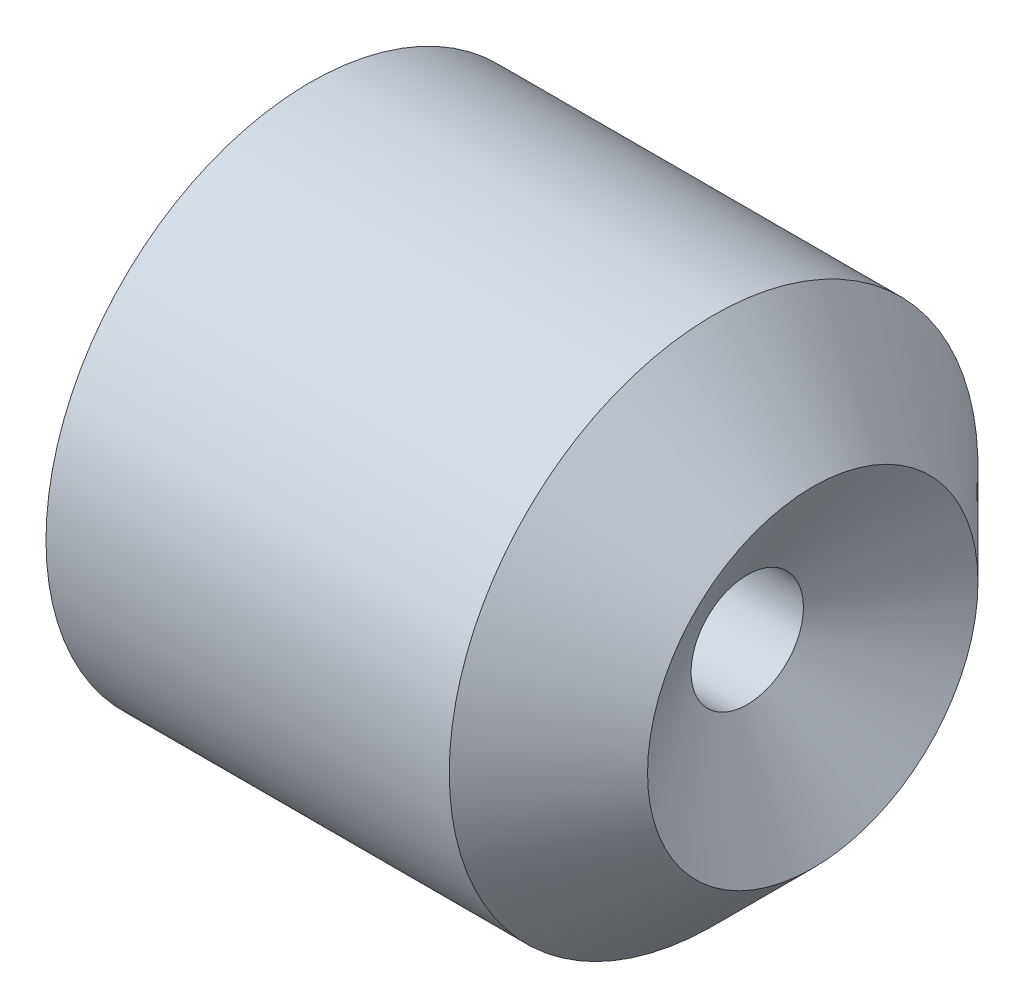
from build123d import *

# Parameters (mm, degrees)
HEX_2_DEPTH        = 4
SKETCH6_R          = 0.85
CUT_EXTRUDE1_DEPTH = 10.797958971


with BuildPart() as part:
    # BodySke → BaseBody (revolve)
    with BuildSketch(Plane.XY, mode=Mode.PRIVATE) as basebody_sk:
        Polygon((0, 0), (0, 3.3095), (0.398660361, 4), (6.5, 4), (8, 2.5), (6.497848452, 0), align=None)
    revolve(basebody_sk.sketch.rotate(Axis((-12.7, 0, 0), (1, 0, 0)), 90), axis=Axis((-12.7, 0, 0), (1, 0, 0)))

    # Sketch2 → Hex 2 (cut)
    with BuildSketch(Plane.ZY):
        Polygon((1.154700538, 2), (-1.154700538, 2), (-2.309401077, 0), (-1.154700538, -2), (1.154700538, -2), (2.309401077, 0), align=None)
    extrude(amount=-HEX_2_DEPTH, mode=Mode.SUBTRACT)

    # Sketch6 → Cut-Extrude1 (cut, through all)
    with BuildSketch(Plane.ZY):
        with Locations(Location((0, 0, 0), (0, 0, 180))):
            Circle(SKETCH6_R)
    extrude(amount=-CUT_EXTRUDE1_DEPTH, mode=Mode.SUBTRACT)


solid = part.part
